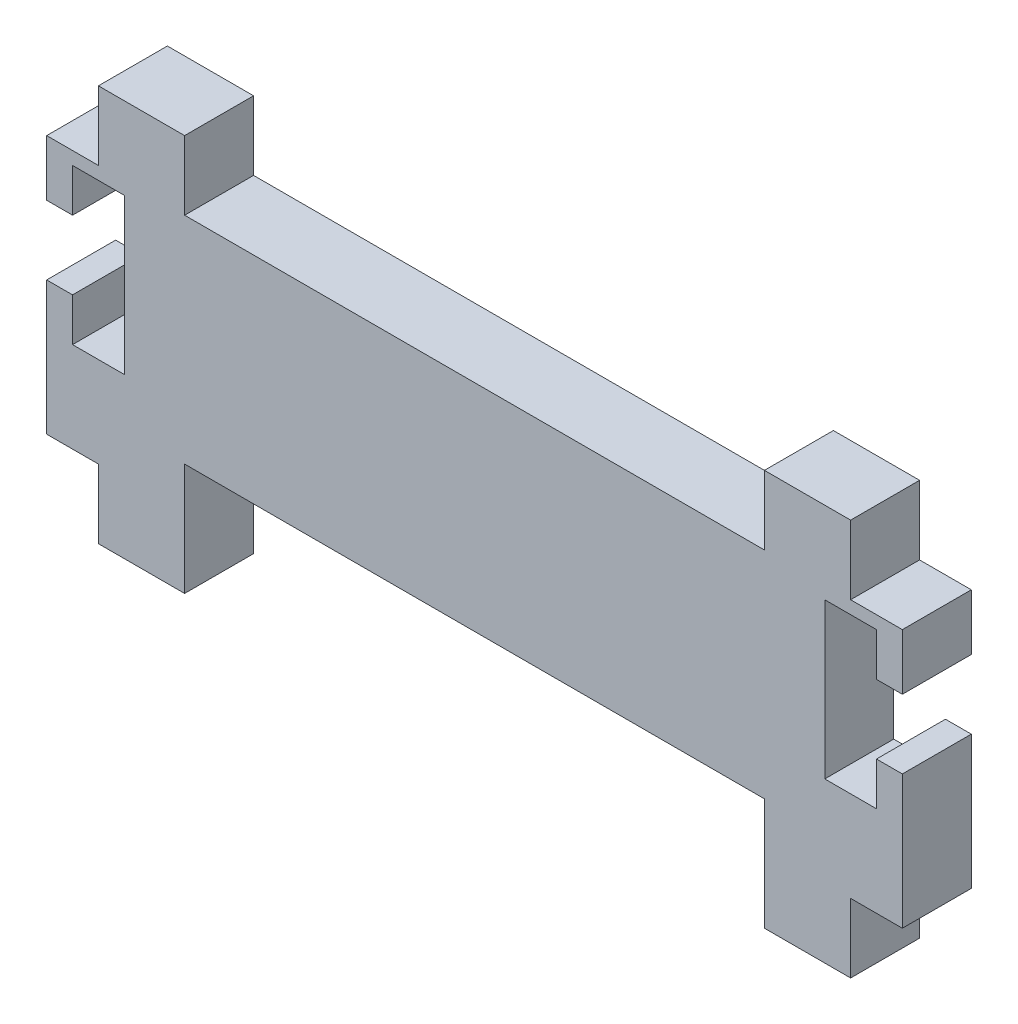
from build123d import *

# Parameters (mm, degrees)
SALIENTE_EXTRUIR1_DEPTH = 4


with BuildPart() as part:
    # Croquis1 → Saliente-Extruir1 (new body)
    with BuildSketch(Plane.XY):
        Polygon((-12.07873839, -9.564080858), (-13.57873839, -9.564080858), (-13.57873839, -17.314080858), (-10.57873839, -17.314080858), (-10.57873839, -21.314080858), (-5.57873839, -21.314080858), (-5.57873839, -17.314080858), (-5.57873839, -14.814080858), (28.05126161, -14.814080858), (28.05126161, -17.314080858), (28.05126161, -21.314080858), (33.05126161, -21.314080858), (33.05126161, -17.314080858), (36.05126161, -17.314080858), (36.05126161, -9.564080858), (34.55126161, -9.564080858), (34.55126161, -12.064080858), (31.55126161, -12.064080858), (31.55126161, -3.064080858), (34.55126161, -3.064080858), (34.55126161, -5.564080858), (36.05126161, -5.564080858), (36.05126161, -2.314080858), (33.05126161, -2.314080858), (33.05126161, 1.685919142), (28.05126161, 1.685919142), (28.05126161, -2.314080858), (-5.57873839, -2.314080858), (-5.57873839, 1.685919142), (-10.57873839, 1.685919142), (-10.57873839, -2.314080858), (-13.57873839, -2.314080858), (-13.57873839, -5.564080858), (-12.07873839, -5.564080858), (-12.07873839, -3.064080858), (-9.07873839, -3.064080858), (-9.07873839, -12.064080858), (-12.07873839, -12.064080858), align=None)
    extrude(amount=SALIENTE_EXTRUIR1_DEPTH)


solid = part.part
